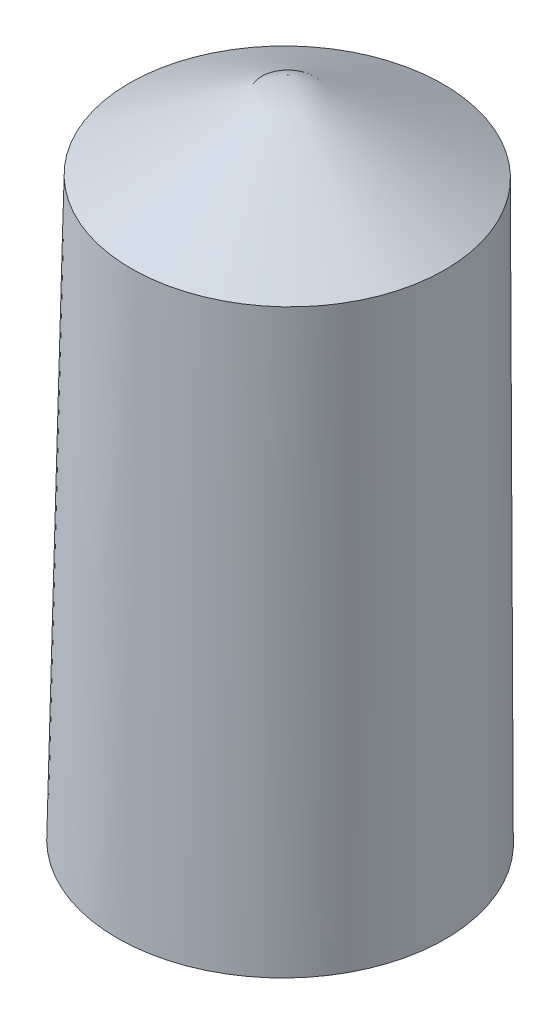
from build123d import *


with BuildPart() as part:
    # Sketch1 → Revolve1 (revolve)
    with BuildSketch(Plane.XY):
        Polygon((0.134184238, 10.80928004), (5, 8), (5, -10), (0, -10), (0, 0), align=None)
    revolve(axis=Axis((0.134184238, 10.80928004, 0), (-0.012412843420750438, -0.9999229576913473, 0)))


solid = part.part
